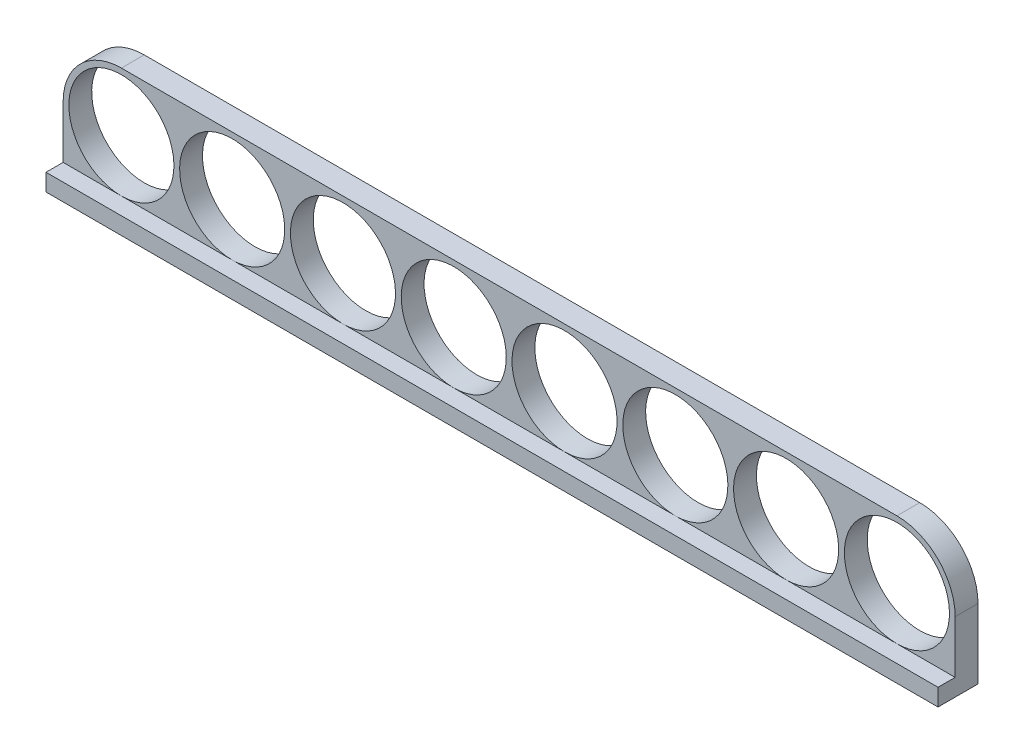
from build123d import *

# Parameters (mm, degrees)
SKETCH1_R           = 9.2
BOSS_EXTRUDE1_DEPTH = 4
SKETCH2_W           = 156.2
SKETCH2_H           = 3
BOSS_EXTRUDE2_DEPTH = 3


with BuildPart() as part:
    # Sketch1 → Boss-Extrude1 (new body)
    with BuildSketch(Plane.XY):
        with BuildLine():
            Line((0, 10.2), (135.8, 10.2))
            ThreePointArc((135.8, 10.2), (143.012489168, 7.212489168), (146, 0))
            Line((146, 0), (146, -12.2))
            Line((146, -12.2), (-10.2, -12.2))
            Line((-10.2, -12.2), (-10.2, 0))
            ThreePointArc((-10.2, 0), (-7.212489168, 7.212489168), (0, 10.2))
        make_face()
        Circle(SKETCH1_R, mode=Mode.SUBTRACT)
        with Locations((19.4, 0)):
            Circle(SKETCH1_R, mode=Mode.SUBTRACT)
        with Locations((38.8, 0)):
            Circle(SKETCH1_R, mode=Mode.SUBTRACT)
        with Locations((58.2, 0)):
            Circle(SKETCH1_R, mode=Mode.SUBTRACT)
        with Locations((77.6, 0)):
            Circle(SKETCH1_R, mode=Mode.SUBTRACT)
        with Locations((97, 0)):
            Circle(SKETCH1_R, mode=Mode.SUBTRACT)
        with Locations((116.4, 0)):
            Circle(SKETCH1_R, mode=Mode.SUBTRACT)
        with Locations((135.8, 0)):
            Circle(SKETCH1_R, mode=Mode.SUBTRACT)
    extrude(amount=BOSS_EXTRUDE1_DEPTH)

    # Sketch2 → Boss-Extrude2 (add)
    with BuildSketch(Plane.XY.offset(4)):
        with Locations((67.9, -10.7)):
            Rectangle(SKETCH2_W, SKETCH2_H)
    extrude(amount=BOSS_EXTRUDE2_DEPTH)


solid = part.part
